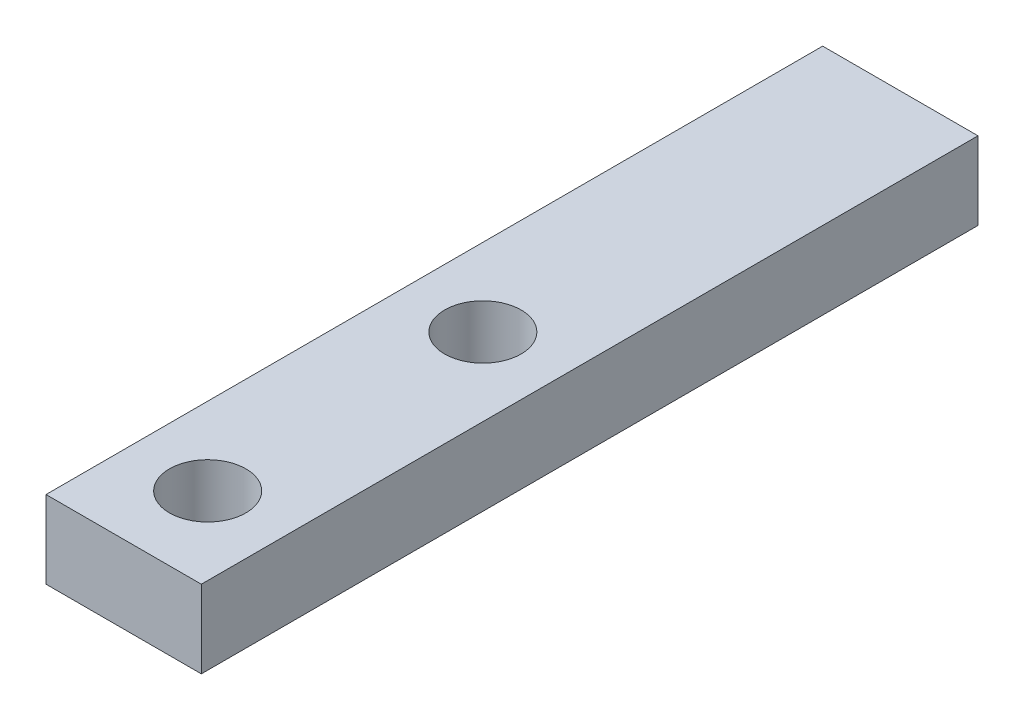
from build123d import *

# Parameters (mm, degrees)
SKETCH1_W           = 5.08
SKETCH1_H           = 25.4
SKETCH1_R           = 1.25
BOSS_EXTRUDE1_DEPTH = 2.54


with BuildPart() as part:
    # Sketch1 → Boss-Extrude1 (new body)
    with BuildSketch(Plane(origin=(0, 0, 0), x_dir=(1, 0, 0), z_dir=(0, 1, 0))):
        with Locations((2.54, 12.7)):
            Rectangle(SKETCH1_W, SKETCH1_H)
        with Locations(Location((2.54, 2.747203238, 0), (0, 0, 270))):
            Circle(SKETCH1_R, mode=Mode.SUBTRACT)
        with Locations(Location((2.54, 11.747203238, 0), (0, 0, 270))):
            Circle(SKETCH1_R, mode=Mode.SUBTRACT)
    extrude(amount=BOSS_EXTRUDE1_DEPTH)


solid = part.part
